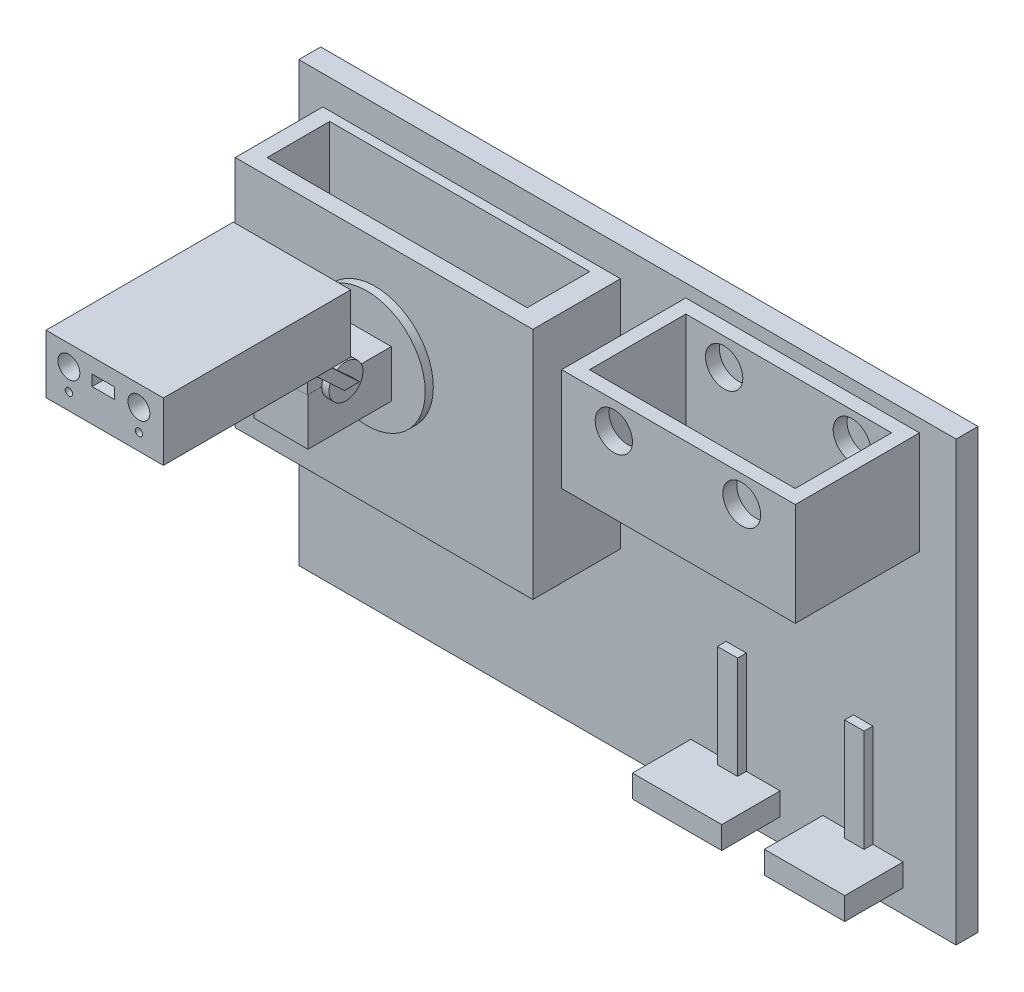
from build123d import *

# Parameters (mm, degrees)
SKETCH2_W                = 450
SKETCH2_H                = 300
BOSS_EXTRUDE1_DEPTH      = 15
SKETCH3_W                = 160
SKETCH3_H                = 70.454173546
BOSS_EXTRUDE2_DEPTH      = 85
SKETCH4_W                = 140.858362714
SKETCH4_H                = 66.01437432
CUT_EXTRUDE1_DEPTH       = 85
SKETCH6_W                = 203.74585323
SKETCH6_H                = 155.189598489
BOSS_EXTRUDE3_DEPTH      = 60
SKETCH7_W                = 178.03960072
SKETCH7_H                = 42.843754184
CUT_EXTRUDE2_DEPTH       = 370.270345082
SKETCH9_R                = 12.773539569
CUT_EXTRUDE3_DEPTH       = 284.460755661
SKETCH10_R               = 12.949734645
CUT_EXTRUDE4_DEPTH       = 284.460755661
SKETCH11_W               = 203.74585323
SKETCH11_H               = 60
BOSS_EXTRUDE4_DEPTH      = 5
SKETCH14_W               = 13.805209682
SKETCH14_H               = 70.454173547
SKETCH14_W_2             = 13.329167969
BOSS_EXTRUDE7_DEPTH      = 6
SKETCH15_W               = 55.005442473
SKETCH15_H               = 15.412152964
SKETCH15_W_2             = 61.117158303
BOSS_EXTRUDE8_DEPTH      = 40
BOSS_EXTRUDE9_DEPTH      = 3
BOSS_EXTRUDE9_DEPTH_BACK = 7.366
SKETCH17_R               = 39.922278331
SKETCH18_W               = 37.131253626
SKETCH18_H               = 32.370836495
BOSS_EXTRUDE10_DEPTH     = 60
SKETCH22_W               = 37.095971173
SKETCH22_H               = 21.602627686
BOSS_EXTRUDE11_DEPTH     = 10
SKETCH23_R               = 11.43
BOSS_EXTRUDE12_DEPTH     = 5
SKETCH24_R               = 11.609284077
BOSS_EXTRUDE13_DEPTH     = 5
BOSS_EXTRUDE14_DEPTH     = 5
BOSS_EXTRUDE15_DEPTH     = 5
SKETCH30_W               = 80.360367193
SKETCH30_H               = 128.21784224
BOSS_EXTRUDE17_DEPTH     = 40
SKETCH35_W               = 71.177586029
SKETCH35_H               = 31.648835894
CUT_EXTRUDE6_DEPTH       = 119.408
SKETCH39_W               = 80.360367193
SKETCH39_H               = 40
BOSS_EXTRUDE19_DEPTH     = 15
SKETCH38_R               = 7.5
SKETCH38_R_2             = 2.5
SKETCH38_W               = 15.252451033
SKETCH38_H               = 7.470588261
CUT_EXTRUDE7_DEPTH       = 20


with BuildPart() as part:
    # Sketch2 → Boss-Extrude1 (new body)
    with BuildSketch(Plane.XY):
        Rectangle(SKETCH2_W, SKETCH2_H)
    extrude(amount=-BOSS_EXTRUDE1_DEPTH)

    # Sketch3 → Boss-Extrude2 (add)
    with BuildSketch(Plane.XY):
        with Locations((119.937519525, 105.919281177)):
            Rectangle(SKETCH3_W, SKETCH3_H)
    extrude(amount=BOSS_EXTRUDE2_DEPTH)

    # Sketch4 → Cut-Extrude1 (cut)
    with BuildSketch(Plane(origin=(0, 141.14636795, 0), x_dir=(1, 0, 0), z_dir=(0, 1, 0))):
        with Locations((119.937519525, -42.5)):
            Rectangle(SKETCH4_W, SKETCH4_H)
    extrude(amount=-CUT_EXTRUDE1_DEPTH, mode=Mode.SUBTRACT)

    # Sketch6 → Boss-Extrude3 (add)
    with BuildSketch(Plane.XY):
        with Locations((-106.633343747, 52.602609303)):
            Rectangle(SKETCH6_W, SKETCH6_H)
    extrude(amount=BOSS_EXTRUDE3_DEPTH)

    # Sketch7 → Cut-Extrude2 (cut, through all)
    with BuildSketch(Plane(origin=(0, 130.197408548, 0), x_dir=(1, 0, 0), z_dir=(0, 1, 0))):
        with Locations((-108.537510599, -27.706846098)):
            Rectangle(SKETCH7_W, SKETCH7_H)
    extrude(amount=-CUT_EXTRUDE2_DEPTH, mode=Mode.SUBTRACT)

    # Sketch9 → Cut-Extrude3 (cut, through all)
    with BuildSketch(Plane.XY):
        with Locations(Location((75.690632392, 122.580741137, 0), (0, 0, 180))):
            Circle(SKETCH9_R)
    extrude(amount=CUT_EXTRUDE3_DEPTH, mode=Mode.SUBTRACT)

    # Sketch10 → Cut-Extrude4 (cut, through all)
    with BuildSketch(Plane.XY):
        with Locations(Location((163.282307612, 123.056782851, 0), (0, 0, 180))):
            Circle(SKETCH10_R)
    extrude(amount=CUT_EXTRUDE4_DEPTH, mode=Mode.SUBTRACT)

    # Sketch11 → Boss-Extrude4 (add)
    with BuildSketch(Plane.XZ.offset(24.992189941)):
        with Locations((-106.633343747, 30)):
            Rectangle(SKETCH11_W, SKETCH11_H)
    extrude(amount=BOSS_EXTRUDE4_DEPTH)

    # Sketch14 → Boss-Extrude7 (add)
    with BuildSketch(Plane.XY):
        with Locations((74.500528109, -83.878921765)):
            Rectangle(SKETCH14_W, SKETCH14_H)
        with Locations((161.37814076, -83.878921765)):
            Rectangle(SKETCH14_W_2, SKETCH14_H)
    extrude(amount=BOSS_EXTRUDE7_DEPTH)

    # Sketch15 → Boss-Extrude8 (add)
    with BuildSketch(Plane.XY):
        with Locations((161.271113451, -126.506349237)):
            Rectangle(SKETCH15_W, SKETCH15_H)
        with Locations((73.979867787, -126.506349237)):
            Rectangle(SKETCH15_W_2, SKETCH15_H)
    extrude(amount=BOSS_EXTRUDE8_DEPTH)


with BuildPart() as body_2:
    # Sketch17 → Boss-Extrude9 (new, two sides: drawn at the far end of the back side and taken through both)
    with BuildSketch(Plane.XY.offset(62.54).offset(-BOSS_EXTRUDE9_DEPTH_BACK)):
        with Locations((-112.821886018, 61.78984246)):
            Circle(SKETCH17_R)
    extrude(amount=BOSS_EXTRUDE9_DEPTH + BOSS_EXTRUDE9_DEPTH_BACK)

    # Sketch18 → Boss-Extrude10 (add)
    with BuildSketch(Plane.XY.offset(62.54)):
        with Locations((-114.72605287, 60.837759034)):
            Rectangle(SKETCH18_W, SKETCH18_H)
    extrude(amount=BOSS_EXTRUDE10_DEPTH)

    # Sketch22 → Boss-Extrude11 (add)
    with BuildSketch(Plane(origin=(0, 77.023177281, 0), x_dir=(1, 0, 0), z_dir=(0, 1, 0))):
        with Locations((-114.743694097, -112.198686157)):
            Rectangle(SKETCH22_W, SKETCH22_H)
    extrude(amount=BOSS_EXTRUDE11_DEPTH)

    # Sketch23 → Boss-Extrude12 (add)
    with BuildSketch(Plane.ZY.offset(133.291679683)):
        with Locations(Location((101.349549357, 77.023177281, 0), (0, 0, 180))):
            Circle(SKETCH23_R)
    extrude(amount=BOSS_EXTRUDE12_DEPTH)

    # Sketch24 → Boss-Extrude13 (add)
    with BuildSketch(Plane(origin=(-96.160426057, 0, 0), x_dir=(0, 0, -1), z_dir=(1, 0, 0))):
        with Locations((-101.528833434, 77.023177281)):
            Circle(SKETCH24_R)
    extrude(amount=BOSS_EXTRUDE13_DEPTH)

    # Sketch25 → Boss-Extrude14 (add)
    with BuildSketch(Plane(origin=(-91.160426057, 0, 0), x_dir=(0, 0, -1), z_dir=(1, 0, 0))):
        Polygon((-97.188050001, 77.023177281), (-107.529010443, 77.023177281), (-139.949318856, 107.054942489), (-129.608358414, 107.054942489), align=None)
    extrude(amount=BOSS_EXTRUDE14_DEPTH)

    # Sketch26 → Boss-Extrude15 (add)
    with BuildSketch(Plane.ZY.offset(138.291679683)):
        Polygon((129.608358414, 107.054942489), (139.949318856, 107.054942489), (107.403918576, 77.023177281), (97.062958134, 77.023177281), align=None)
    extrude(amount=BOSS_EXTRUDE15_DEPTH)

    # Sketch30 → Boss-Extrude17 (add)
    with BuildSketch(Plane(origin=(0, 107.054942489, 0), x_dir=(1, 0, 0), z_dir=(0, 1, 0))):
        with Locations((-113.850415669, -179.928026333)):
            Rectangle(SKETCH30_W, SKETCH30_H)
    extrude(amount=BOSS_EXTRUDE17_DEPTH)

    # Sketch35 → Cut-Extrude6 (cut)
    with BuildSketch(Plane.XY.offset(244.036947453)):
        with Locations((-113.638642199, 127.334985672)):
            Rectangle(SKETCH35_W, SKETCH35_H)
    extrude(amount=-CUT_EXTRUDE6_DEPTH, mode=Mode.SUBTRACT)

    # Sketch39 → Boss-Extrude19 (add)
    with BuildSketch(Plane.XY.offset(244.036947453)):
        with Locations((-113.850415669, 127.054942489)):
            Rectangle(SKETCH39_W, SKETCH39_H)
    extrude(amount=-BOSS_EXTRUDE19_DEPTH)

    # Sketch38 → Cut-Extrude7 (cut)
    with BuildSketch(Plane.XY.offset(244.036947453)):
        with Locations((-138.378706494, 133.13656573)):
            Circle(SKETCH38_R)
        with Locations((-138.378706494, 118.351026463)):
            Circle(SKETCH38_R_2)
        with Locations((-90.442431819, 133.13656573)):
            Circle(SKETCH38_R)
        with Locations((-90.442431819, 118.351026463)):
            Circle(SKETCH38_R_2)
        with Locations((-114.877480923, 133.13656573)):
            Rectangle(SKETCH38_W, SKETCH38_H)
    extrude(amount=-CUT_EXTRUDE7_DEPTH, mode=Mode.SUBTRACT)


solid = Compound([part.part, body_2.part])
